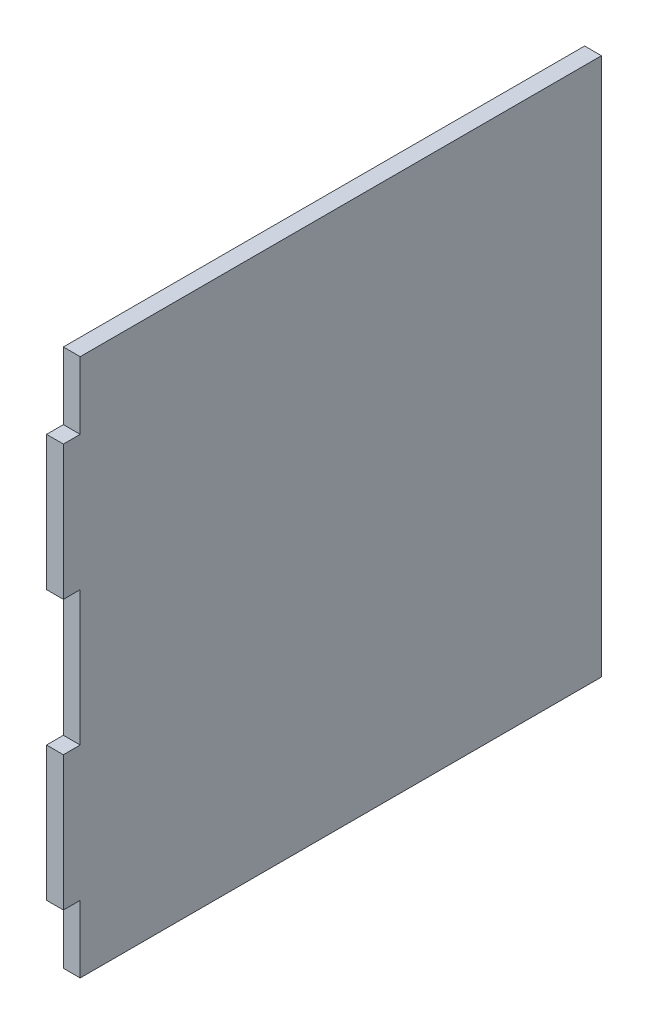
from build123d import *

# Parameters (mm, degrees)
SKETCH1_W           = 160
SKETCH1_H           = 160
BOSS_EXTRUDE1_DEPTH = 5
SKETCH2_W           = 5
SKETCH2_H           = 20
SKETCH2_H_2         = 40
CUT_EXTRUDE1_DEPTH  = 114.247516529


with BuildPart() as part:
    # Sketch1 → Boss-Extrude1 (new body)
    with BuildSketch(Plane(origin=(0, 0, 0), x_dir=(0, 0, -1), z_dir=(1, 0, 0))):
        Rectangle(SKETCH1_W, SKETCH1_H)
    extrude(amount=BOSS_EXTRUDE1_DEPTH)

    # Sketch2 → Cut-Extrude1 (cut, through all)
    with BuildSketch(Plane(origin=(5, 0, 0), x_dir=(0, 0, -1), z_dir=(1, 0, 0))):
        with Locations((-77.5, 70)):
            Rectangle(SKETCH2_W, SKETCH2_H)
        with Locations((-77.5, 0)):
            Rectangle(SKETCH2_W, SKETCH2_H_2)
        with Locations((-77.5, -70)):
            Rectangle(SKETCH2_W, SKETCH2_H)
    extrude(amount=-CUT_EXTRUDE1_DEPTH, mode=Mode.SUBTRACT)


solid = part.part
